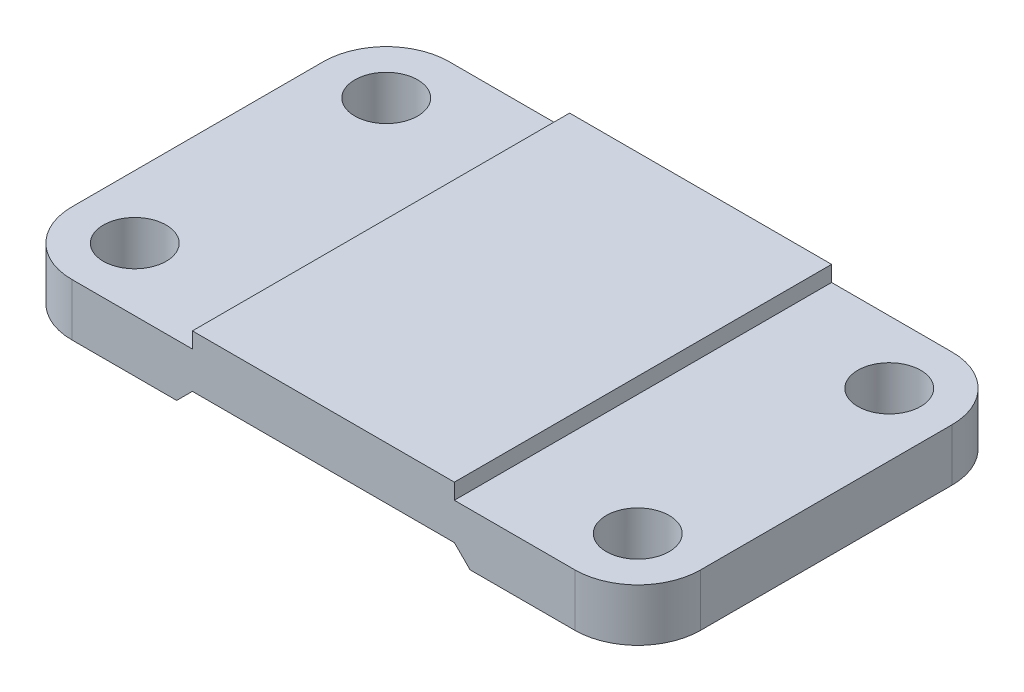
from build123d import *

# Parameters (mm, degrees)
BOSS_EXTRUDE1_DEPTH = 72
SKETCH2_R           = 6
CUT_EXTRUDE1_DEPTH  = 72


with BuildPart() as part:
    # Sketch1 → Boss-Extrude1 (new body)
    with BuildSketch(Plane.XY):
        Polygon((0, 0), (0, 10), (35, 10), (35, 13), (85, 13), (85, 10), (120, 10), (120, 0), (88, 0), (85, 3), (35, 3), (32, 0), align=None)
    extrude(amount=BOSS_EXTRUDE1_DEPTH)

    # Sketch2 → Cut-Extrude1 (cut)
    with BuildSketch(Plane(origin=(0, 10, 0), x_dir=(1, 0, 0), z_dir=(0, 1, 0))):
        with BuildLine():
            ThreePointArc((0, -12), (3.514718626, -3.514718626), (12, 0))
            Line((12, 0), (0, 0))
            Line((0, 0), (0, -12))
        make_face()
        with BuildLine():
            Line((120, 0), (108, 0))
            ThreePointArc((108, 0), (116.485281374, -3.514718626), (120, -12))
            Line((120, -12), (120, 0))
        make_face()
        with BuildLine():
            Line((120, -72), (120, -60))
            ThreePointArc((120, -60), (116.485281374, -68.485281374), (108, -72))
            Line((108, -72), (120, -72))
        make_face()
        with Locations(Location((108, -60, 0), (0, 0, 270))):
            Circle(SKETCH2_R)
        with Locations(Location((108, -12, 0), (0, 0, 270))):
            Circle(SKETCH2_R)
        with Locations(Location((12, -60, 0), (0, 0, 270))):
            Circle(SKETCH2_R)
        with Locations(Location((12, -12, 0), (0, 0, 270))):
            Circle(SKETCH2_R)
        with BuildLine():
            ThreePointArc((12, -72), (3.514718626, -68.485281374), (0, -60))
            Line((0, -60), (0, -72))
            Line((0, -72), (12, -72))
        make_face()
    extrude(amount=-CUT_EXTRUDE1_DEPTH, mode=Mode.SUBTRACT)


solid = part.part
